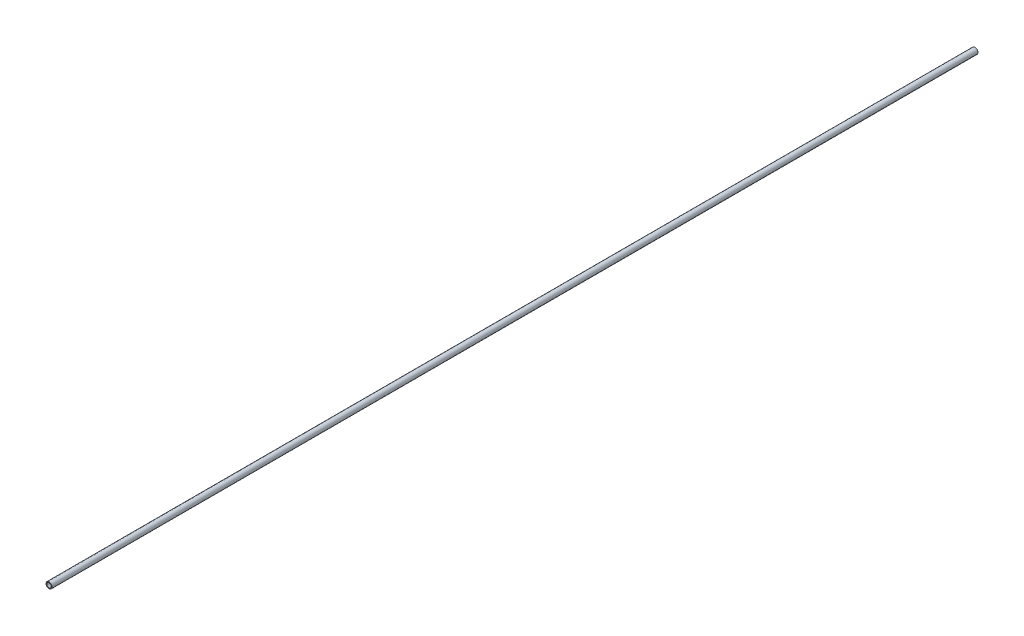
from build123d import *

# Parameters (mm, degrees)
SKETCH_1_R      = 4
SKETCH_1_R_2    = 3
EXTRUDE_1_DEPTH = 1233


with BuildPart() as part:
    # 草图1 → 凸台-拉伸1 (new body)
    with BuildSketch(Plane.XY):
        Circle(SKETCH_1_R)
        Circle(SKETCH_1_R_2, mode=Mode.SUBTRACT)
    extrude(amount=EXTRUDE_1_DEPTH)


solid = part.part
